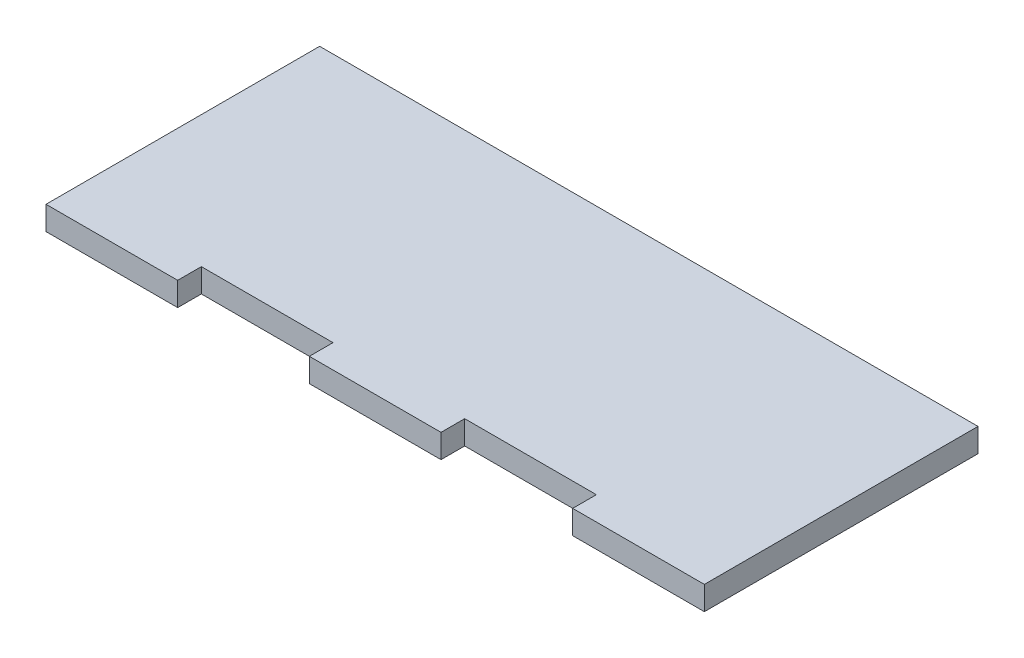
from build123d import *

# Parameters (mm, degrees)
SKETCH1_W           = 200.5584
SKETCH1_H           = 83.3628
BOSS_EXTRUDE1_DEPTH = 7.2136
SKETCH2_W           = 40.11168
SKETCH2_H           = 7.2136
CUT_EXTRUDE1_DEPTH  = 158.17894412


with BuildPart() as part:
    # Sketch1 → Boss-Extrude1 (new body)
    with BuildSketch(Plane(origin=(0, 0, 0), x_dir=(1, 0, 0), z_dir=(0, 1, 0))):
        with Locations((30.558206772, 45.121580587)):
            Rectangle(SKETCH1_W, SKETCH1_H)
    extrude(amount=BOSS_EXTRUDE1_DEPTH)

    # Sketch2 → Cut-Extrude1 (cut, through all)
    with BuildSketch(Plane.XZ):
        with Locations((70.669886772, -7.046980587)):
            Rectangle(SKETCH2_W, SKETCH2_H)
        with Locations((-9.553473228, -7.046980587)):
            Rectangle(SKETCH2_W, SKETCH2_H)
    extrude(amount=-CUT_EXTRUDE1_DEPTH, mode=Mode.SUBTRACT)


solid = part.part
